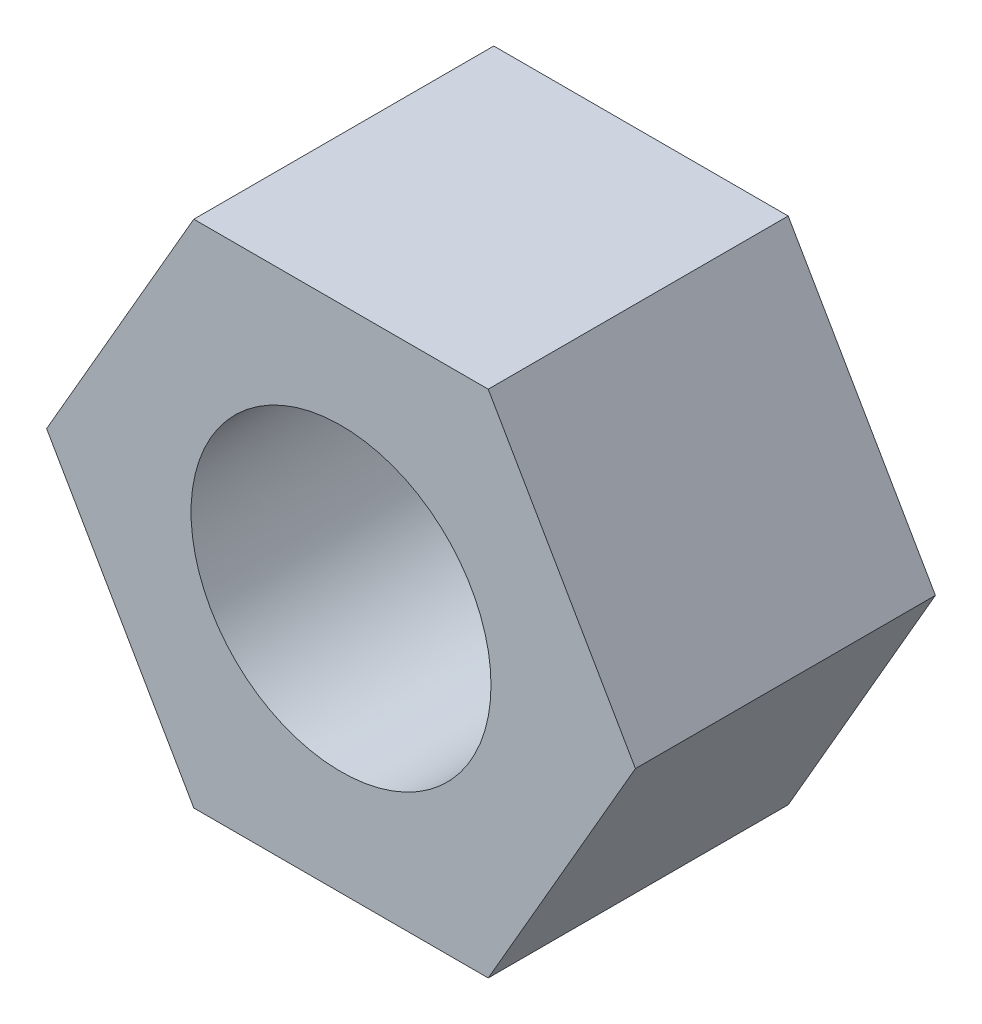
from build123d import *

# Parameters (mm, degrees)
BOSS_EXTRUDE1_DEPTH = 10
SKETCH2_R           = 5
CUT_EXTRUDE1_DEPTH  = 10


with BuildPart() as part:
    # Sketch1 → Boss-Extrude1 (new body)
    with BuildSketch(Plane.XY):
        Polygon((4.907477288, 8.5), (-4.907477288, 8.5), (-9.814954576, 0), (-4.907477288, -8.5), (4.907477288, -8.5), (9.814954576, 0), align=None)
    extrude(amount=BOSS_EXTRUDE1_DEPTH)

    # Sketch2 → Cut-Extrude1 (cut)
    with BuildSketch(Plane.XY.offset(10)):
        Circle(SKETCH2_R)
    extrude(amount=-CUT_EXTRUDE1_DEPTH, mode=Mode.SUBTRACT)


solid = part.part
